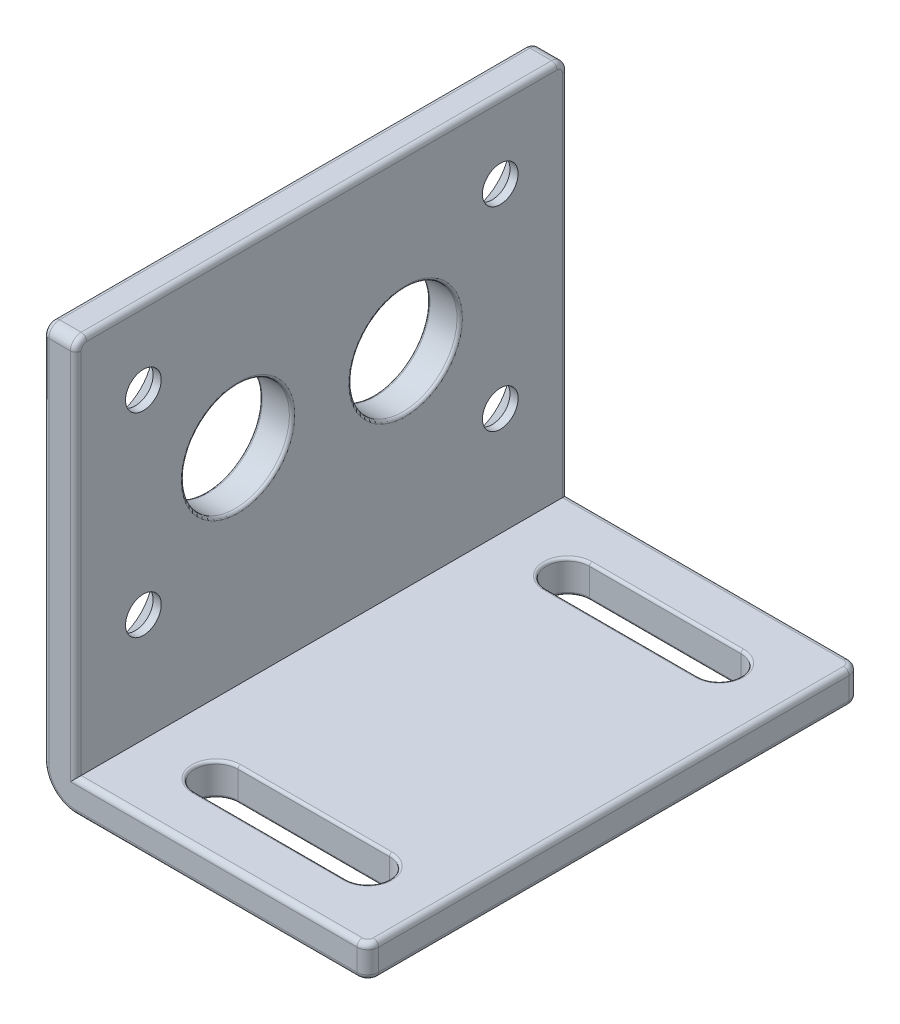
from build123d import *

# Parameters (mm, degrees)
EXTRUDE_1_DEPTH     = 45.5
SKETCH_3_R          = 1.65
SKETCH_3_R_2        = 5
CUT_EXTRUDE_1_DEPTH = 67.439822396
CHAMFER_2_SIZE      = 2.25
CUT_EXTRUDE_2_DEPTH = 67.439822396
FILLET_1_R          = 1
FILLET_2_R          = 3
FILLET_3_R          = 0.5
FILLET_4_R          = 0.25


with BuildPart() as part:
    # 草图2 → 凸台-拉伸1 (new body)
    with BuildSketch(Plane.XY):
        Polygon((0, 0), (0, 38), (3, 38), (3, 3), (30, 3), (30, 0), align=None)
    extrude(amount=-EXTRUDE_1_DEPTH)

    # 草图3 → 切除-拉伸1 (cut, through all)
    with BuildSketch(Plane.ZY):
        with Locations((-39.25, 31)):
            Circle(SKETCH_3_R)
        with Locations((-30.5, 22)):
            Circle(SKETCH_3_R_2)
        with Locations((-39.25, 13)):
            Circle(SKETCH_3_R)
        with Locations((-15, 22)):
            Circle(SKETCH_3_R_2)
        with Locations((-6.25, 13)):
            Circle(SKETCH_3_R)
        with Locations((-6.25, 31)):
            Circle(SKETCH_3_R)
    extrude(amount=-CUT_EXTRUDE_1_DEPTH, mode=Mode.SUBTRACT)

    # 倒角2
    chamfer_2_edges = [part.edges().sort_by_distance(p)[0] for p in [
        (0, 31, -7.9),
        (0, 13, -7.9),
        (0, 13, -40.9),
        (0, 31, -40.9),
    ]]
    chamfer(chamfer_2_edges, length=CHAMFER_2_SIZE)

    # 草图4 → 切除-拉伸2 (cut, through all)
    with BuildSketch(Plane.XZ):
        with BuildLine():
            ThreePointArc((23.5, -37), (25.5, -39), (23.5, -41))
            Line((23.5, -41), (9.5, -41))
            ThreePointArc((9.5, -41), (7.5, -39), (9.5, -37))
            Line((9.5, -37), (23.5, -37))
        make_face()
        with BuildLine():
            Line((9.5, -8.5), (23.5, -8.5))
            ThreePointArc((23.5, -8.5), (25.5, -6.5), (23.5, -4.5))
            Line((23.5, -4.5), (9.5, -4.5))
            ThreePointArc((9.5, -4.5), (7.5, -6.5), (9.5, -8.5))
        make_face()
    extrude(amount=-CUT_EXTRUDE_2_DEPTH, mode=Mode.SUBTRACT)

    # 圆角1
    fillet_1_edges = [part.edges().sort_by_distance(p)[0] for p in [
        (1.5, 38, -45.5),
        (1.5, 38, 0),
        (30, 1.5, 0),
        (30, 1.5, -45.5),
    ]]
    fillet(fillet_1_edges, radius=FILLET_1_R)

    # 圆角2
    fillet_2_edges = [part.edges().sort_by_distance(p)[0] for p in [
        (0, 0, -22.75),
    ]]
    fillet(fillet_2_edges, radius=FILLET_2_R)

    # 圆角3
    fillet_3_edges = [part.edges().sort_by_distance(p)[0] for p in [
        (30, 0, -22.75),
        (30, 3, -22.75),
        (16, 3, 0),
        (16, 3, -45.5),
        (29.707106781, 3, -0.292893219),
        (29.707106781, 3, -45.207106781),
        (0, 20, -45.5),
        (29.707106781, 0, -0.292893219),
        (29.707106781, 0, -45.207106781),
        (0, 20, 0),
        (3, 38, -22.75),
        (0, 38, -22.75),
        (0, 37.707106781, -0.292893219),
        (0, 37.707106781, -45.207106781),
        (3, 37.707106781, -0.292893219),
        (3, 37.707106781, -45.207106781),
        (16, 0, 0),
        (0.878679656, 0.878679656, 0),
        (16, 0, -45.5),
        (0.878679656, 0.878679656, -45.5),
        (3, 20, -45.5),
        (3, 20, 0),
    ]]
    fillet(fillet_3_edges, radius=FILLET_3_R)

    # 圆角4
    fillet_4_edges = [part.edges().sort_by_distance(p)[0] for p in [
        (3, 22, -20),
        (0, 22, -20),
        (3, 22, -35.5),
        (0, 22, -35.5),
        (25.5, 3, -6.5),
        (16.5, 3, -4.5),
        (7.5, 3, -6.5),
        (16.5, 3, -8.5),
        (16.5, 3, -37),
        (7.5, 3, -39),
        (16.5, 3, -41),
        (25.5, 3, -39),
        (25.5, 0, -39),
        (7.5, 0, -39),
        (16.5, 0, -37),
        (16.5, 0, -41),
        (16.5, 0, -4.5),
        (16.5, 0, -8.5),
        (25.5, 0, -6.5),
        (7.5, 0, -6.5),
    ]]
    fillet(fillet_4_edges, radius=FILLET_4_R)


solid = part.part
